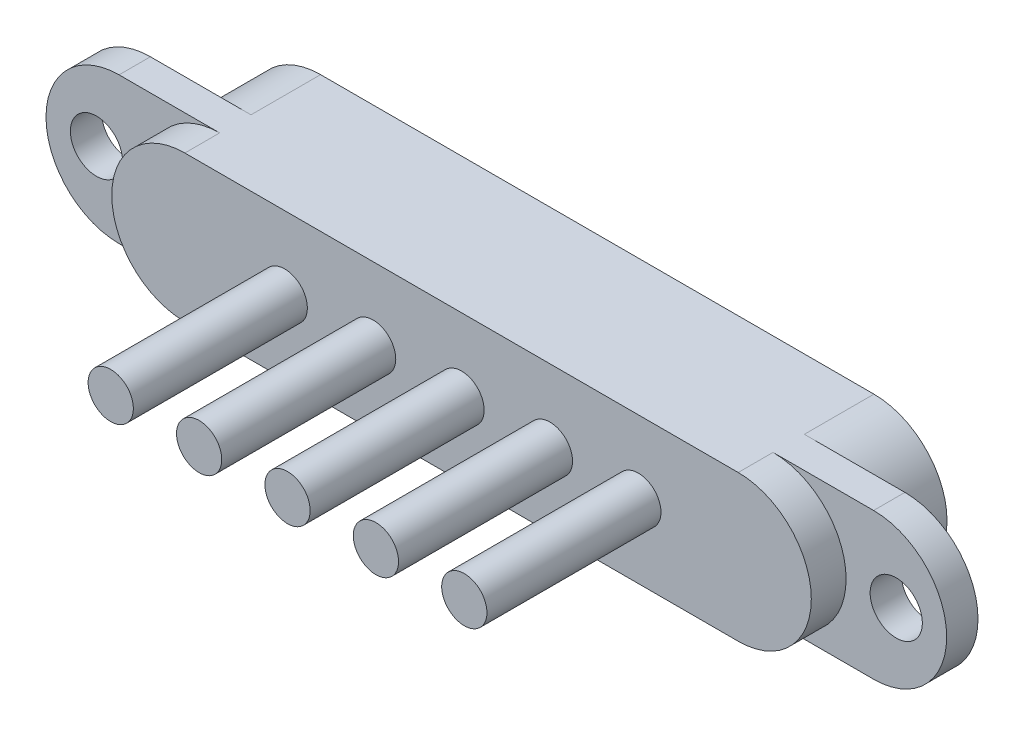
from build123d import *

# Parameters (mm, degrees)
BOSS_EXTRUDE1_DEPTH = 2
BOSS_EXTRUDE2_DEPTH = 0.9
SKETCH3_R           = 0.75
CUT_EXTRUDE1_DEPTH  = 0.9
SKETCH4_R           = 0.65
SKETCH4_R_2         = 1.5
CUT_EXTRUDE2_DEPTH  = 0.1
BOSS_EXTRUDE3_DEPTH = 1
SKETCH6_R           = 0.65
BOSS_EXTRUDE4_DEPTH = 5


with BuildPart() as part:
    # Sketch1 → Boss-Extrude1 (new body)
    with BuildSketch(Plane.XY):
        with BuildLine():
            Line((-7.95, 2.1), (7.95, 2.1))
            ThreePointArc((7.95, 2.1), (10.05, 0), (7.95, -2.1))
            Line((7.95, -2.1), (-7.95, -2.1))
            ThreePointArc((-7.95, -2.1), (-10.05, 0), (-7.95, 2.1))
        make_face()
    extrude(amount=BOSS_EXTRUDE1_DEPTH)

    # Sketch2 → Boss-Extrude2 (add)
    with BuildSketch(Plane.XY.offset(2)):
        with BuildLine():
            Line((-10.84, 2.1), (10.84, 2.1))
            ThreePointArc((10.84, 2.1), (12.94, 0), (10.84, -2.1))
            Line((10.84, -2.1), (-10.84, -2.1))
            ThreePointArc((-10.84, -2.1), (-12.94, 0), (-10.84, 2.1))
        make_face()
    extrude(amount=BOSS_EXTRUDE2_DEPTH)

    # Sketch3 → Cut-Extrude1 (cut)
    with BuildSketch(Plane(origin=(0, 0, 2), x_dir=(-1, 0, 0), z_dir=(0, 0, -1))):
        with Locations((-11.49, 0)):
            Circle(SKETCH3_R)
        with Locations((11.49, 0)):
            Circle(SKETCH3_R)
    extrude(amount=-CUT_EXTRUDE1_DEPTH, mode=Mode.SUBTRACT)

    # Sketch4 → Cut-Extrude2 (cut)
    with BuildSketch(Plane(origin=(0, 0, 0), x_dir=(-1, 0, 0), z_dir=(0, 0, -1))):
        Circle(SKETCH4_R)
        with Locations((2.54, 0)):
            Circle(SKETCH4_R)
        with Locations((5.08, 0)):
            Circle(SKETCH4_R)
        with Locations((-2.54, 0)):
            Circle(SKETCH4_R)
        with Locations((-5.08, 0)):
            Circle(SKETCH4_R)
        with Locations((-8, 0)):
            Circle(SKETCH4_R_2)
        with Locations((8, 0)):
            Circle(SKETCH4_R_2)
    extrude(amount=-CUT_EXTRUDE2_DEPTH, mode=Mode.SUBTRACT)

    # Sketch5 → Boss-Extrude3 (add)
    with BuildSketch(Plane.XY.offset(2.9)):
        with BuildLine():
            Line((7.95, 2.1), (-7.95, 2.1))
            ThreePointArc((-7.95, 2.1), (-10.05, 0), (-7.95, -2.1))
            Line((-7.95, -2.1), (7.95, -2.1))
            ThreePointArc((7.95, -2.1), (10.05, 0), (7.95, 2.1))
        make_face()
    extrude(amount=BOSS_EXTRUDE3_DEPTH)

    # Sketch6 → Boss-Extrude4 (add)
    with BuildSketch(Plane.XY.offset(3.9)):
        with Locations(Location((-5.08, 0, 0), (0, 0, 180))):
            Circle(SKETCH6_R)
        with Locations(Location((-2.54, 0, 0), (0, 0, 180))):
            Circle(SKETCH6_R)
        with Locations(Location((0, 0, 0), (0, 0, 180))):
            Circle(SKETCH6_R)
        with Locations(Location((2.54, 0, 0), (0, 0, 180))):
            Circle(SKETCH6_R)
        with Locations(Location((5.08, 0, 0), (0, 0, 180))):
            Circle(SKETCH6_R)
    extrude(amount=BOSS_EXTRUDE4_DEPTH)


solid = part.part
